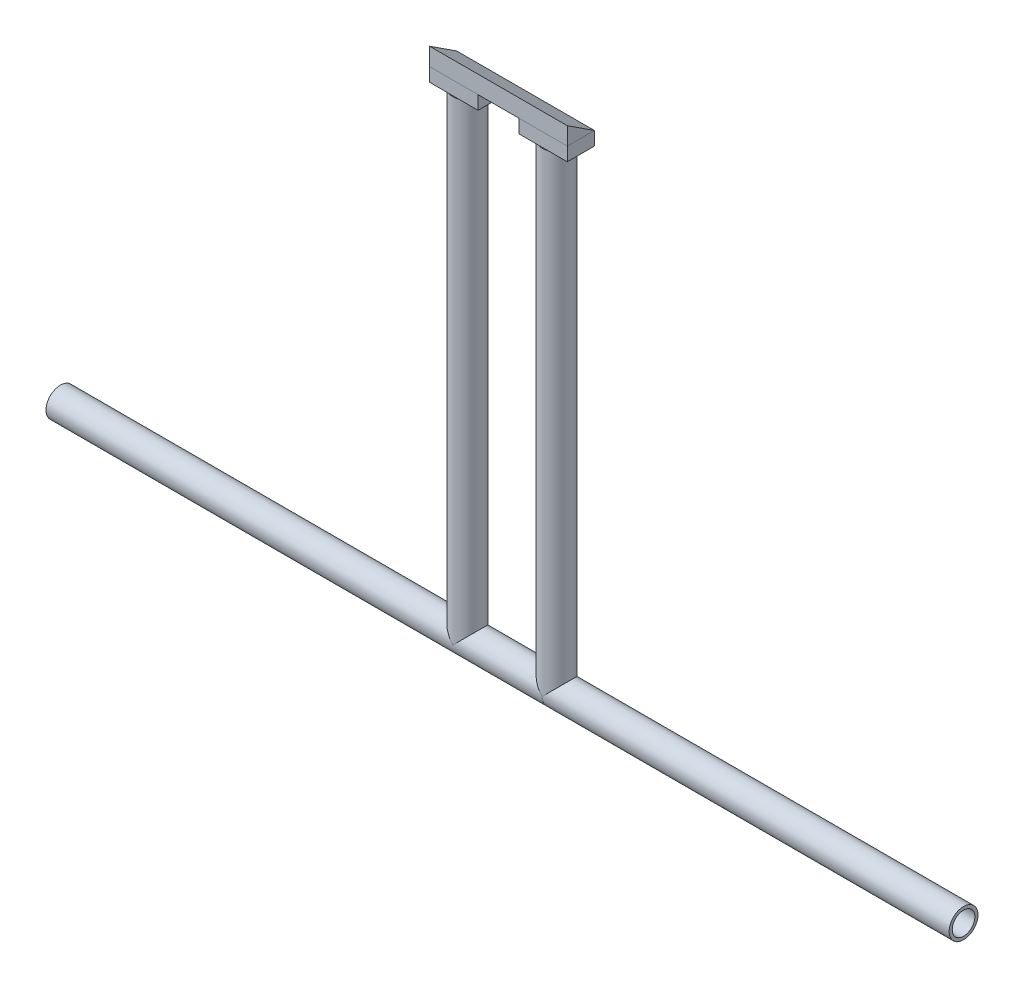
from build123d import *

# Parameters (mm, degrees)
SKETCH12_R                           = 10.65
SKETCH12_R_2                         = 8.35
PIPE_CONFIGURED_21_3_X_2_3_1_DEPTH   = 350
SKETCH12_ON_SEGMENT_2_R              = 10.65
SKETCH12_ON_SEGMENT_2_R_2            = 8.35
PIPE_CONFIGURED_21_3_X_2_3_1_2_DEPTH = 350
SKETCH13_R                           = 10.65
SKETCH13_R_2                         = 8.35
PIPE_CONFIGURED_21_3_X_2_3_2_DEPTH   = 300
SKETCH13_ON_SEGMENT_2_R              = 10.65
SKETCH13_ON_SEGMENT_2_R_2            = 8.35
PIPE_CONFIGURED_21_3_X_2_3_2_2_DEPTH = 365.75
SKETCH15_W                           = 35.75
SKETCH15_H                           = 20
BOSS_EXTRUDE3_DEPTH                  = 10
BOSS_EXTRUDE3_2_DEPTH                = 10
BOSS_EXTRUDE4_DEPTH                  = 101.5


with BuildPart() as part:
    # Sketch12 → Pipe - configured 21.3 X 2.3(1) (new body)
    with BuildSketch(Plane(origin=(-65.75, 0, 0), x_dir=(-1, 0, 0), z_dir=(0, 1, 0))):
        Circle(SKETCH12_R)
        Circle(SKETCH12_R_2, mode=Mode.SUBTRACT)
    extrude(amount=PIPE_CONFIGURED_21_3_X_2_3_1_DEPTH)


with BuildPart() as body_2:
    # Sketch12 on segment 2 (carried to segment 2) → Pipe - configured 21.3 X 2.3_1 2 (new body)
    with BuildSketch(Plane(origin=(0, 0, 0), x_dir=(-1, 0, 0), z_dir=(0, 1, 0))):
        Circle(SKETCH12_ON_SEGMENT_2_R)
        Circle(SKETCH12_ON_SEGMENT_2_R_2, mode=Mode.SUBTRACT)
    extrude(amount=PIPE_CONFIGURED_21_3_X_2_3_1_2_DEPTH)


with BuildPart() as body_3:
    # Sketch13 → Pipe - configured 21.3 X 2.3(2) (new body)
    with BuildSketch(Plane(origin=(0, 0, 0), x_dir=(0, -1, 0), z_dir=(-1, 0, 0))):
        Circle(SKETCH13_R)
        Circle(SKETCH13_R_2, mode=Mode.SUBTRACT)
    extrude(amount=-PIPE_CONFIGURED_21_3_X_2_3_2_DEPTH)


with BuildPart() as body_4:
    # Sketch13 on segment 2 (carried to segment 2) → Pipe - configured 21.3 X 2.3_2 2 (new body)
    with BuildSketch(Plane(origin=(0, 0, 0), x_dir=(0, -1, 0), z_dir=(-1, 0, 0))):
        Circle(SKETCH13_ON_SEGMENT_2_R)
        Circle(SKETCH13_ON_SEGMENT_2_R_2, mode=Mode.SUBTRACT)
    extrude(amount=PIPE_CONFIGURED_21_3_X_2_3_2_2_DEPTH)


with BuildPart() as body_5:
    # Sketch15 → Boss-Extrude3 (new body)
    with BuildSketch(Plane(origin=(0, 350, 0), x_dir=(1, 0, 0), z_dir=(0, 1, 0))):
        with Locations((-65.75, 0)):
            Rectangle(SKETCH15_W, SKETCH15_H)
    extrude(amount=BOSS_EXTRUDE3_DEPTH)


with BuildPart() as body_6:
    # Sketch15 → Boss-Extrude3 2 (new body)
    with BuildSketch(Plane(origin=(0, 350, 0), x_dir=(1, 0, 0), z_dir=(0, 1, 0))):
        Rectangle(SKETCH15_W, SKETCH15_H)
    extrude(amount=BOSS_EXTRUDE3_2_DEPTH)


with BuildPart() as body_7:
    # Sketch16 → Boss-Extrude4 (new body)
    with BuildSketch(Plane.ZY.offset(83.625)):
        Polygon((10, 360), (10, 373.036425871), (-10, 360), align=None)
    extrude(amount=-BOSS_EXTRUDE4_DEPTH)


solid = Compound([part.part, body_2.part, body_3.part, body_4.part, body_5.part, body_6.part, body_7.part])
